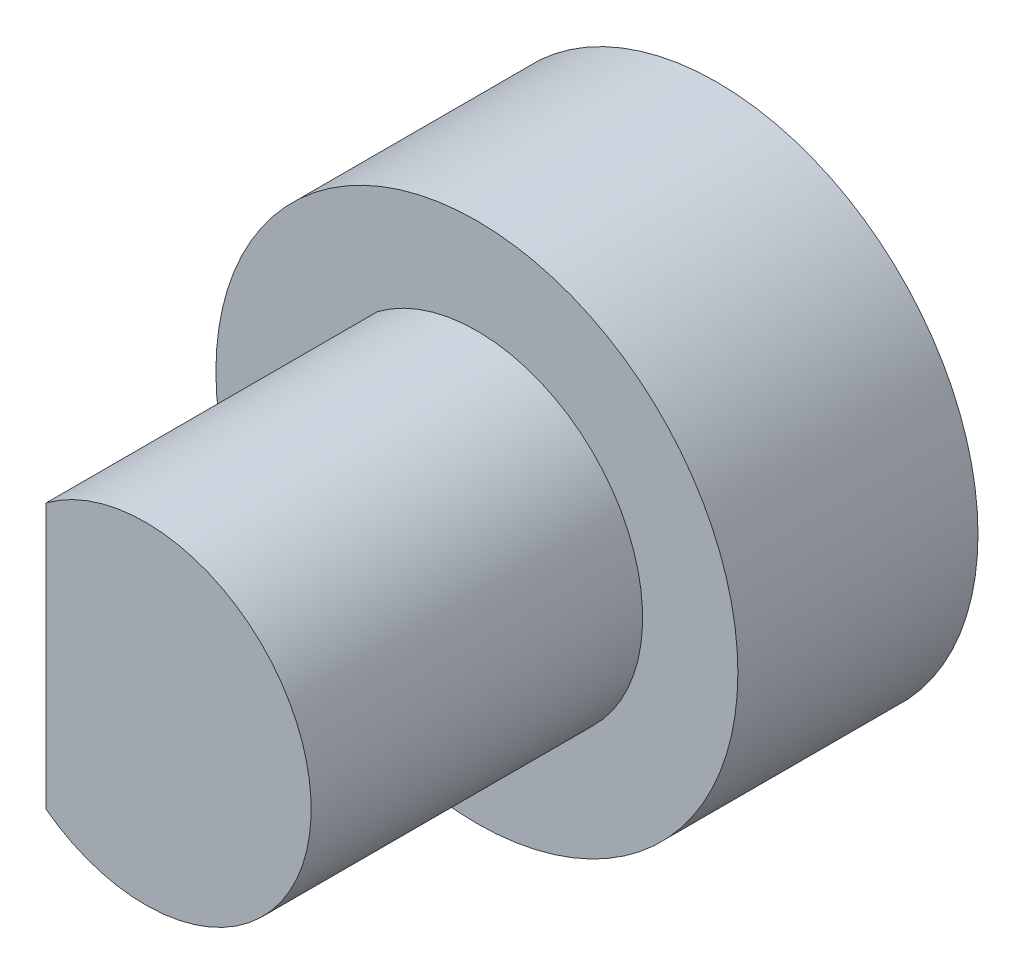
from build123d import *

# Parameters (mm, degrees)
SKETCH1_R           = 3.175
BOSS_EXTRUDE1_DEPTH = 14
CUT_EXTRUDE2_START  = -6.35
CUT_EXTRUDE2_DEPTH  = 6.35
SKETCH7_R           = 3.175
CUT_EXTRUDE4_DEPTH  = 3.05
SKETCH9_R           = 5
SKETCH9_R_2         = 1.3890625
BOSS_EXTRUDE2_DEPTH = 4.6
SKETCH9_3_R         = 1.3890625
CUT_EXTRUDE5_DEPTH  = 4.6


with BuildPart() as part:
    # Sketch1 → Boss-Extrude1 (new body)
    with BuildSketch(Plane.XY):
        Circle(SKETCH1_R)
    extrude(amount=BOSS_EXTRUDE1_DEPTH)

    # Sketch2 → Cut-Extrude2 (cut)
    with BuildSketch(Plane.XY.offset(14).offset(CUT_EXTRUDE2_START)):
        with BuildLine():
            Line((-1.905, 2.54), (-1.905, -2.54))
            ThreePointArc((-1.905, -2.54), (-3.175, 0), (-1.905, 2.54))
        make_face()
    extrude(amount=CUT_EXTRUDE2_DEPTH, mode=Mode.SUBTRACT)

    # Sketch7 → Cut-Extrude4 (cut)
    with BuildSketch(Plane(origin=(0, 0, 0), x_dir=(-1, 0, 0), z_dir=(0, 0, -1))):
        with Locations(Location((0, 0, 0), (0, 0, 306.869897646))):
            Circle(SKETCH7_R)
    extrude(amount=-CUT_EXTRUDE4_DEPTH, mode=Mode.SUBTRACT)

    # Sketch9 → Boss-Extrude2 (add)
    with BuildSketch(Plane(origin=(0, 0, 3.05), x_dir=(-1, 0, 0), z_dir=(0, 0, -1))):
        Circle(SKETCH9_R)
        Circle(SKETCH9_R_2, mode=Mode.SUBTRACT)
    extrude(amount=-BOSS_EXTRUDE2_DEPTH)

    # Sketch9<3> → Cut-Extrude5 (cut)
    with BuildSketch(Plane(origin=(0, 0, 3.05), x_dir=(-1, 0, 0), z_dir=(0, 0, -1))):
        Circle(SKETCH9_3_R)
    extrude(amount=-CUT_EXTRUDE5_DEPTH, mode=Mode.SUBTRACT)


solid = part.part
